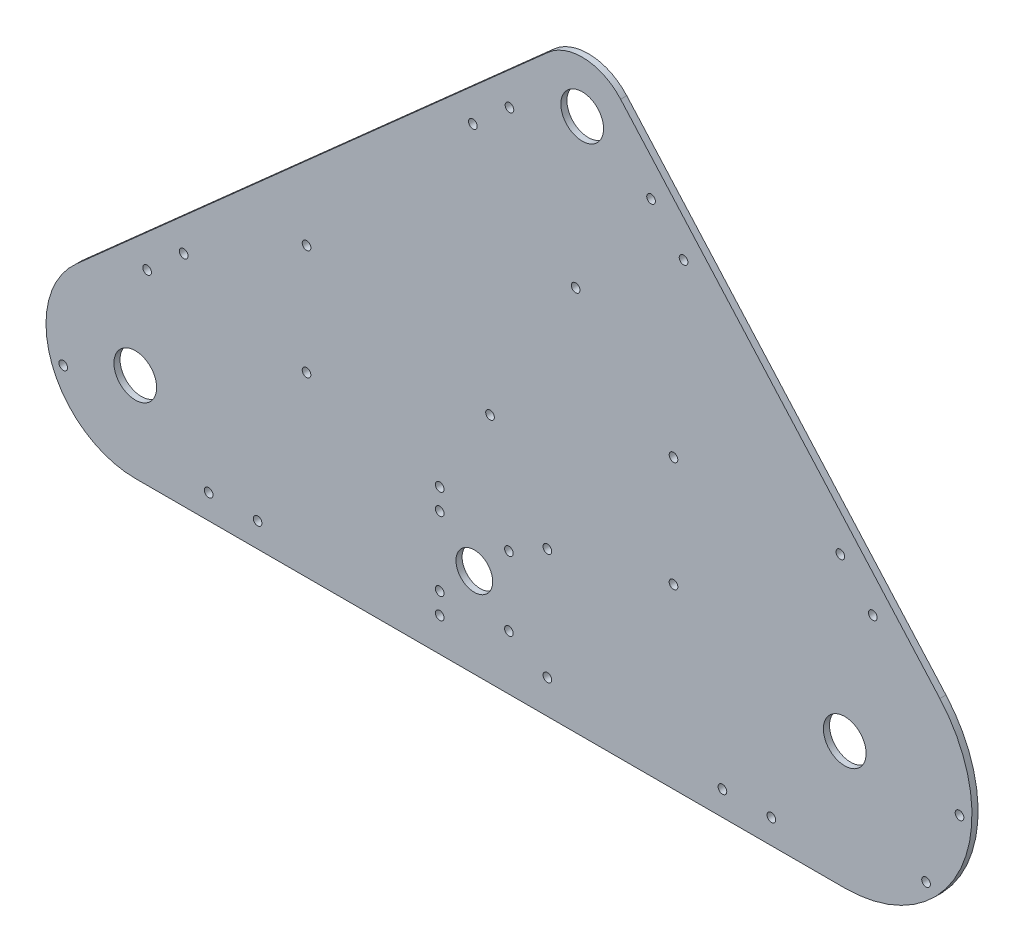
from build123d import *

# Parameters (mm, degrees)
SKETCH1_R                 = 11.0998
SKETCH1_R_2               = 9.525
BOSS_EXTRUDE1_DEPTH       = 3.175
F_8_CLEARANCE_HOLE1_D     = 4.4958
F_8_CLEARANCE_HOLE1_DEPTH = 12.7
F_8_CLEARANCE_HOLE1_TIP   = 1.350674586
F_8_CLEARANCE_HOLE2_D     = 4.4958


with BuildPart() as part:
    # Sketch1 → Boss-Extrude1 (new body)
    with BuildSketch(Plane.XY):
        with BuildLine():
            Line((-188.264639147, 81.011774484), (56.809800323, 298.704514086))
            ThreePointArc((56.809800323, 298.704514086), (76.096805757, 305.388436009), (94.461024604, 296.476710194))
            Line((94.461024604, 296.476710194), (260.194034881, 109.897568099))
            ThreePointArc((260.194034881, 109.897568099), (271.059668812, 38.975929697), (210.82, 0))
            Line((210.82, 0), (-157.48, 0))
            ThreePointArc((-157.48, 0), (-200.811863601, 29.88880366), (-188.264639147, 81.011774484))
        make_face()
        with Locations((-157.48, 46.355)):
            Circle(SKETCH1_R, mode=Mode.SUBTRACT)
        with Locations((74.521510517, 278.765)):
            Circle(SKETCH1_R, mode=Mode.SUBTRACT)
        with Locations((210.82, 66.04)):
            Circle(SKETCH1_R, mode=Mode.SUBTRACT)
        with Locations((18.5166, 46.355)):
            Circle(SKETCH1_R_2, mode=Mode.SUBTRACT)
    extrude(amount=BOSS_EXTRUDE1_DEPTH)

    # #8 Clearance Hole1
    with Locations(Plane.XY.offset(3.175)):
        with Locations((36.477112242, 64.315512242), (36.477112242, 28.394487758), (0.556087758, 28.394487758), (0.556087758, 64.315512242)):
            Hole(F_8_CLEARANCE_HOLE1_D / 2, depth=F_8_CLEARANCE_HOLE1_DEPTH)
            with Locations((0, 0, -(F_8_CLEARANCE_HOLE1_DEPTH + F_8_CLEARANCE_HOLE1_TIP / 2))):  # 118° drill point
                Cone(0, F_8_CLEARANCE_HOLE1_D / 2, F_8_CLEARANCE_HOLE1_TIP, mode=Mode.SUBTRACT)

    # #8 Clearance Hole2 (through all)
    with Locations(Plane.XY.offset(3.175)):
        with Locations((17.768914495, 247.038768822), (36.758927911, 263.907064244), (110.26846103, 259.557542359), (127.136756453, 240.567528943), (208.528289616, 148.938453927), (225.396585039, 129.948440511), (270.394698688, 62.514995218), (253.027203769, 23.832796231), (172.72, 12.7), (147.32, 12.7), (-93.98, 12.7), (-119.38, 12.7), (-194.875991874, 32.144446994), (-151.345471312, 96.81921091), (-132.355457896, 113.687506333), (-68.58, 149.225), (-68.58, 92.075), (121.92, 92.075), (121.92, 149.225), (71.12, 200.025), (26.67, 120.65), (0.556087758, 75.2475), (56.436087758, 75.2475), (56.436087758, 17.4625), (0.556087758, 17.4625)):
            Hole(F_8_CLEARANCE_HOLE2_D / 2)


solid = part.part
